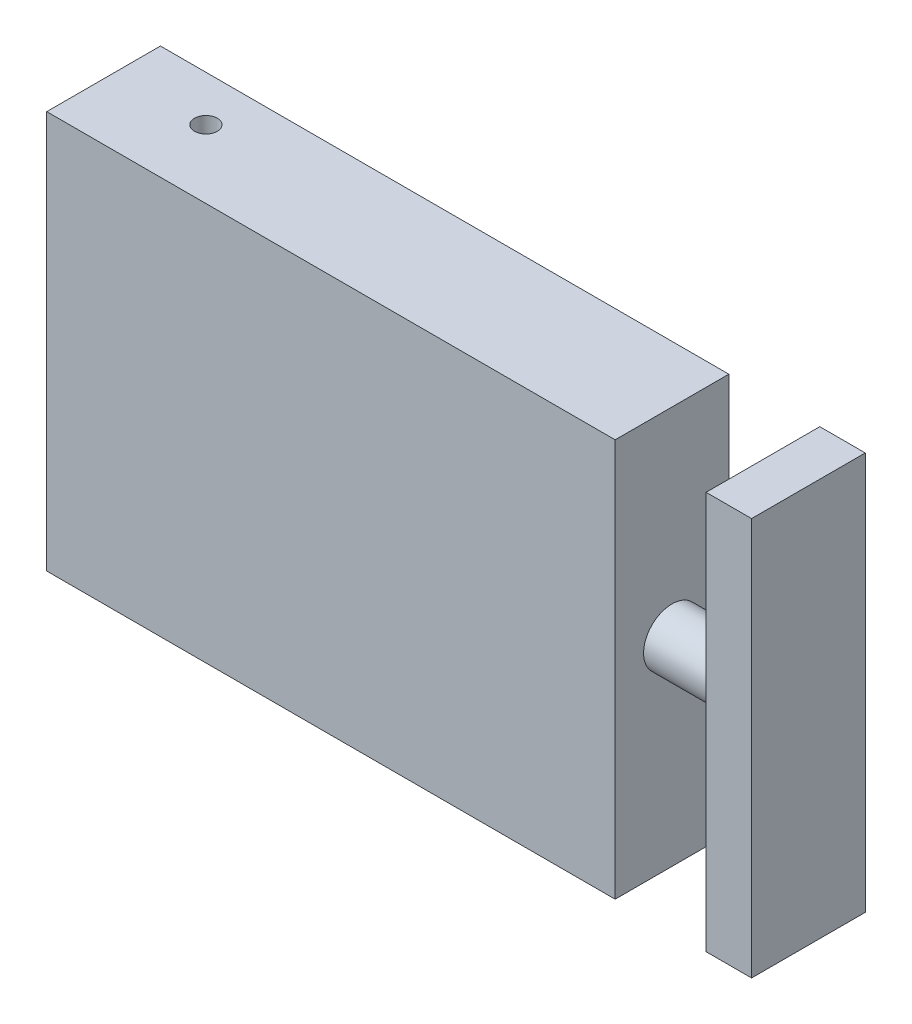
from build123d import *

# Parameters (mm, degrees)
SKETCH1_W           = 500
SKETCH1_H           = 350
BOSS_EXTRUDE1_DEPTH = 100
SKETCH2_R           = 10
CUT_EXTRUDE1_DEPTH  = 619.465843843
REVOLVE1_ANGLE      = 180
SKETCH4_R           = 25
BOSS_EXTRUDE2_DEPTH = 80
SKETCH5_W           = 100
SKETCH5_H           = 350
BOSS_EXTRUDE3_DEPTH = 40


with BuildPart() as part:
    # Sketch1 → Boss-Extrude1 (new body)
    with BuildSketch(Plane.XY):
        with Locations((250, -175)):
            Rectangle(SKETCH1_W, SKETCH1_H)
    extrude(amount=BOSS_EXTRUDE1_DEPTH)

    # Sketch2 → Cut-Extrude1 (cut, through all)
    with BuildSketch(Plane.XZ.offset(350)):
        with Locations(Location((80, 40, 0), (0, 0, 270))):
            Circle(SKETCH2_R)
    extrude(amount=-CUT_EXTRUDE1_DEPTH, mode=Mode.SUBTRACT)

    # Sketch3 → Revolve1 (revolve)
    with BuildSketch(Plane(origin=(0, 0, 0), x_dir=(-1, 0, 0), z_dir=(0, 0, -1))):
        with BuildLine():
            Line((-440, -175), (-320, -175))
            ThreePointArc((-320, -175), (-380, -235), (-440, -175))
        make_face()
    revolve(axis=Axis((500, -175, 0), (1, 0, 0)), revolution_arc=REVOLVE1_ANGLE)

    # Sketch4 → Boss-Extrude2 (add)
    with BuildSketch(Plane(origin=(500, 0, 0), x_dir=(0, 0, -1), z_dir=(1, 0, 0))):
        with Locations(Location((-50, -175, 0), (0, 0, 270))):
            Circle(SKETCH4_R)
    extrude(amount=BOSS_EXTRUDE2_DEPTH)

    # Sketch5 → Boss-Extrude3 (add)
    with BuildSketch(Plane(origin=(580, 0, 0), x_dir=(0, 0, -1), z_dir=(1, 0, 0))):
        with Locations((-50, -175)):
            Rectangle(SKETCH5_W, SKETCH5_H)
    extrude(amount=BOSS_EXTRUDE3_DEPTH)


solid = part.part
